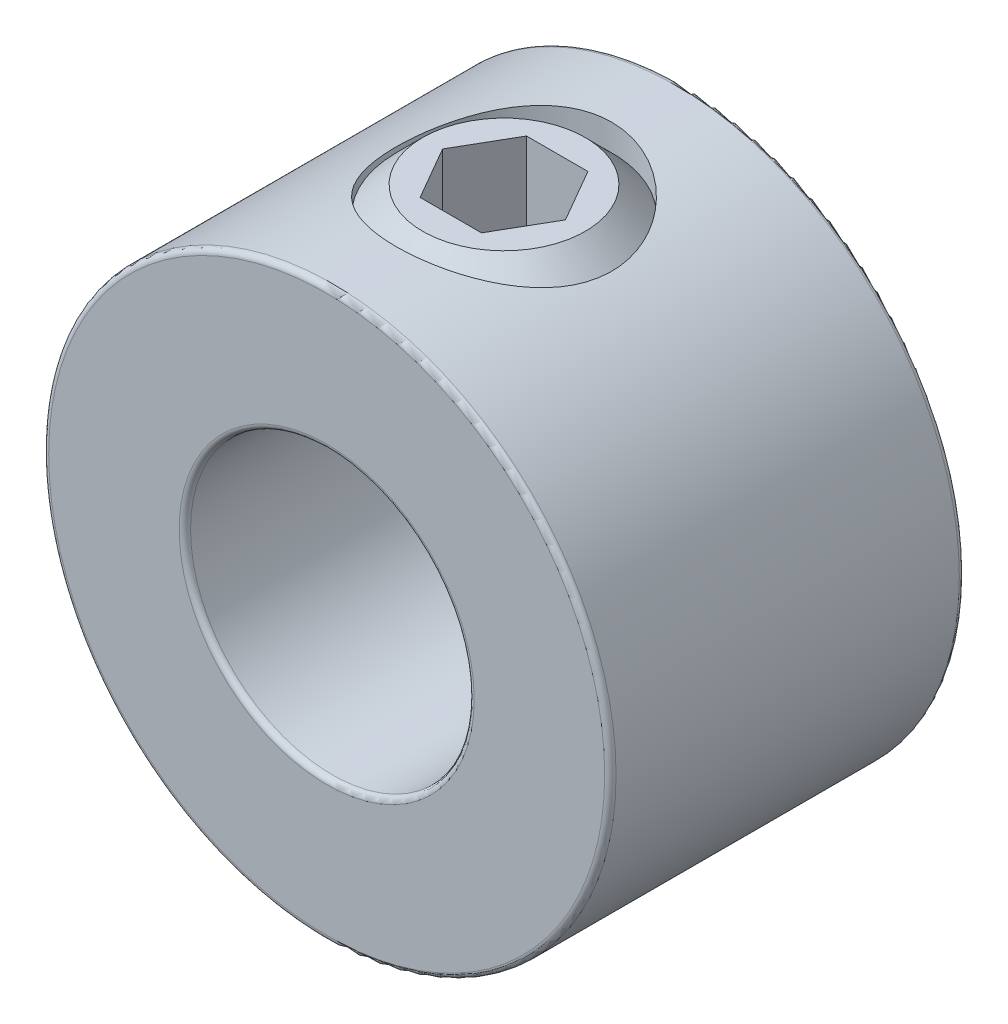
from build123d import *

# Parameters (mm, degrees)
SKETCH1_R          = 6.35
SKETCH1_R_2        = 3.175
EXTRUDE1_DEPTH     = 3.96875
SKETCH2_R          = 2.413
CUT_EXTRUDE1_DEPTH = 49.210103729
FILLET1_R          = 0.127
CUT_EXTRUDE2_DEPTH = 2.38125


with BuildPart() as part:
    # Sketch1 → Extrude1 (new, symmetric)
    with BuildSketch(Plane.XY):
        Circle(SKETCH1_R)
        Circle(SKETCH1_R_2, mode=Mode.SUBTRACT)
    extrude(amount=EXTRUDE1_DEPTH, both=True)

    # Sketch2 → Cut-Extrude1 (cut, through all)
    with BuildSketch(Plane(origin=(41.275, 0, 0), x_dir=(0, 0, -1), z_dir=(0, -1, 0))):
        with Locations((0, -41.275)):
            Circle(SKETCH2_R)
    extrude(amount=-CUT_EXTRUDE1_DEPTH, mode=Mode.SUBTRACT)

    # Fillet1
    fillet1_edges = [part.edges().sort_by_distance(p)[0] for p in [
        (-6.35, 0, -3.96875),
        (-6.35, 0, 3.96875),
        (-3.175, 0, -3.96875),
        (-3.175, 0, 3.96875),
    ]]
    fillet(fillet1_edges, radius=FILLET1_R)


with BuildPart() as body_2:
    # Sketch3 → Revolve1 (revolve)
    with BuildSketch(Plane.XY):
        Polygon((-1.819751616, 3.175), (-0.71189806, 3.175), (0, 3.88689806), (0, 6.35), (-1.819751616, 6.35), (-2.413, 5.756751616), (-2.413, 3.768248384), align=None)
    revolve(axis=Axis((0, 3.175, 0), (0, -1, 0)))

    # Sketch4 → Cut-Extrude2 (cut)
    with BuildSketch(Plane(origin=(3.3734375, 6.35, 0), x_dir=(0, 0, -1), z_dir=(0, -1, 0))):
        Polygon((0, -1.998622171), (-1.190625, -2.686029836), (-1.190625, -4.060845164), (0, -4.748252829), (1.190625, -4.060845164), (1.190625, -2.686029836), align=None)
    extrude(amount=CUT_EXTRUDE2_DEPTH, mode=Mode.SUBTRACT)


solid = Compound([part.part, body_2.part])
